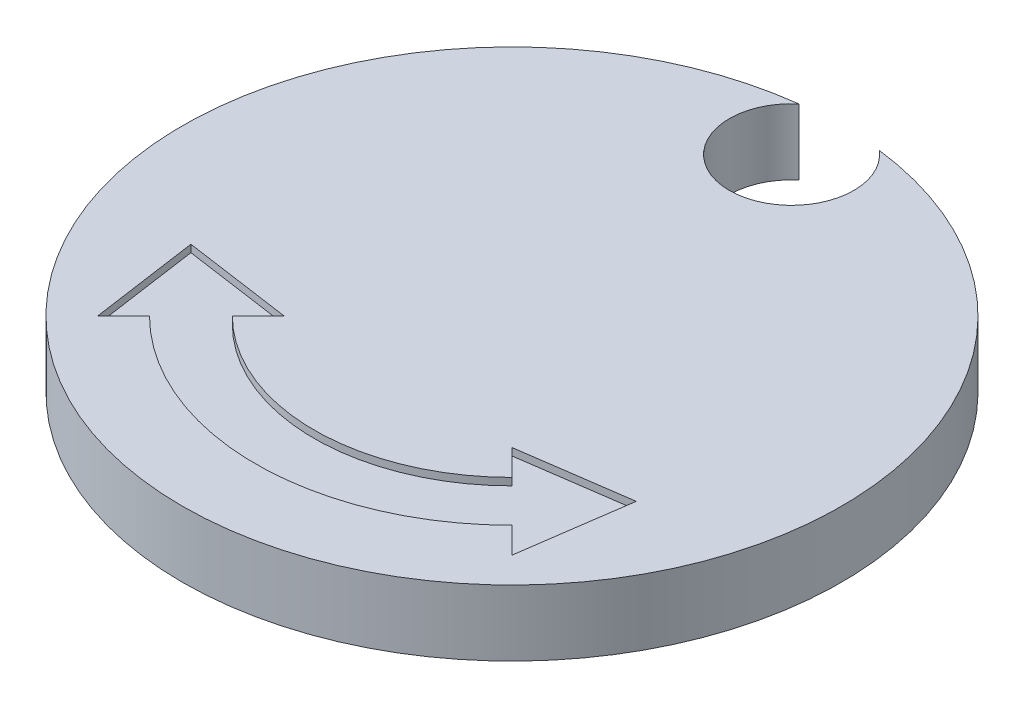
from build123d import *

# Parameters (mm, degrees)
SKETCH1_R           = 45
BOSS_EXTRUDE1_DEPTH = 9
SKETCH3_R           = 8.5
CUT_EXTRUDE2_DEPTH  = 10
SKETCH4_R           = 3
BOSS_EXTRUDE2_DEPTH = 6
SKETCH5_R           = 2.5
CUT_EXTRUDE3_DEPTH  = 5
CUT_EXTRUDE4_DEPTH  = 1


with BuildPart() as part:
    # Sketch1 → Boss-Extrude1 (new body)
    with BuildSketch(Plane(origin=(0, 0, 0), x_dir=(1, 0, 0), z_dir=(0, 1, 0))):
        with Locations(Location((0, 0, 0), (0, 0, 270))):
            Circle(SKETCH1_R)
    extrude(amount=BOSS_EXTRUDE1_DEPTH)

    # Sketch3 → Cut-Extrude2 (cut)
    with BuildSketch(Plane(origin=(0, 9, 0), x_dir=(1, 0, 0), z_dir=(0, 1, 0))):
        with Locations((0, 38.181883497)):
            Circle(SKETCH3_R)
    extrude(amount=-CUT_EXTRUDE2_DEPTH, mode=Mode.SUBTRACT)

    # Sketch4 → Boss-Extrude2 (add)
    with BuildSketch(Plane.XZ):
        with Locations(Location((0, 0, 0), (0, 0, 90))):
            Circle(SKETCH4_R)
    extrude(amount=BOSS_EXTRUDE2_DEPTH)

    # Sketch5 → Cut-Extrude3 (cut)
    with BuildSketch(Plane.XZ.offset(6)):
        with Locations(Location((0, 0, 0), (0, 0, 270))):
            Circle(SKETCH5_R)
    extrude(amount=-CUT_EXTRUDE3_DEPTH, mode=Mode.SUBTRACT)

    # Sketch6 → Cut-Extrude4 (cut)
    with BuildSketch(Plane(origin=(0, 9, 0), x_dir=(1, 0, 0), z_dir=(0, 1, 0))):
        with BuildLine():
            Line((-24.748737342, -24.748737342), (-28.284271247, -28.284271247))
            Line((-28.284271247, -28.284271247), (-30.405591591, -13.435028843))
            Line((-30.405591591, -13.435028843), (-15.556349186, -15.556349186))
            Line((-15.556349186, -15.556349186), (-19.091883092, -19.091883092))
            ThreePointArc((-19.091883092, -19.091883092), (-1.515e-06, -27), (19.09188095, -19.091885234))
            Line((19.09188095, -19.091885234), (15.556347044, -15.556351328))
            Line((15.556347044, -15.556351328), (30.405589449, -13.435030985))
            Line((30.405589449, -13.435030985), (28.284269105, -28.284273389))
            Line((28.284269105, -28.284273389), (24.7487352, -24.748739484))
            ThreePointArc((24.7487352, -24.748739484), (-1.515e-06, -35), (-24.748737342, -24.748737342))
        make_face()
    extrude(amount=-CUT_EXTRUDE4_DEPTH, mode=Mode.SUBTRACT)


solid = part.part
